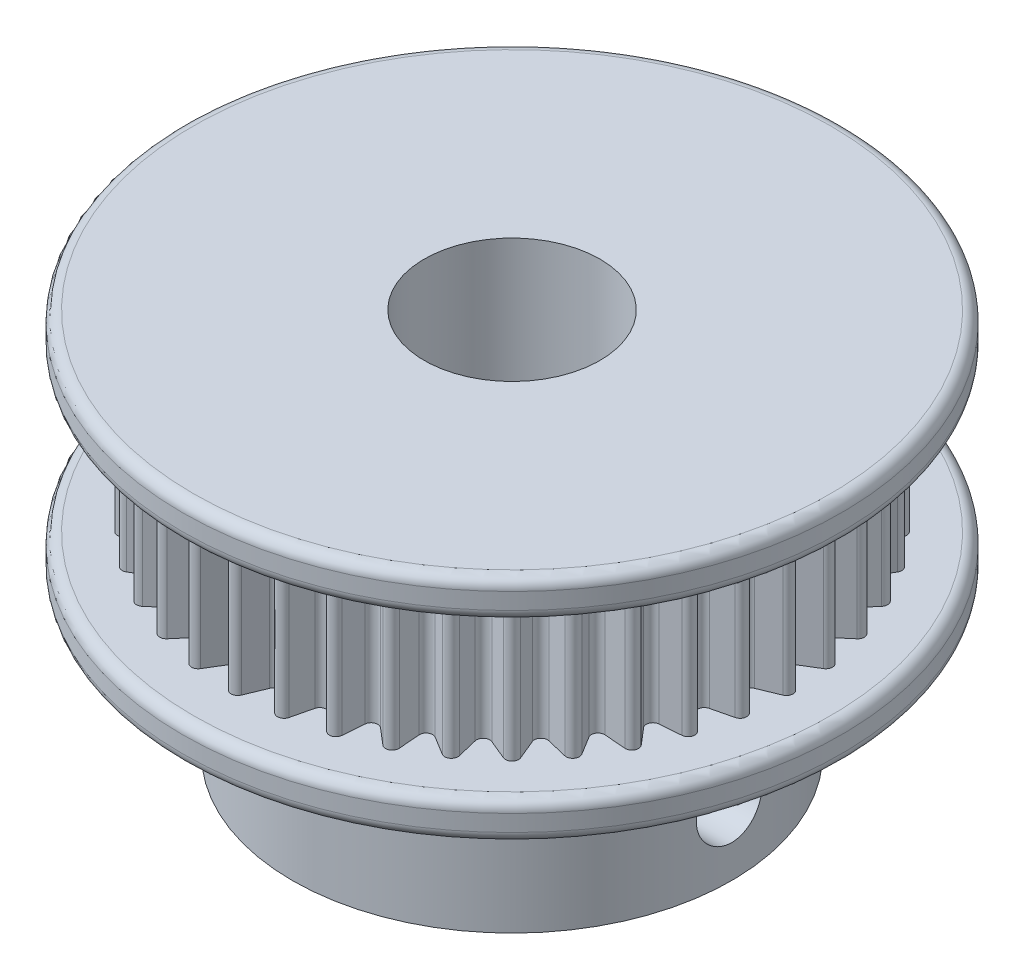
from build123d import *

# Parameters (mm, degrees)
SKETCH1_R           = 10
BOSS_EXTRUDE1_DEPTH = 7
SKETCH7_R           = 15
BOSS_EXTRUDE5_DEPTH = 1.75
BOSS_EXTRUDE7_DEPTH = 7
SKETCH8_R           = 15
BOSS_EXTRUDE6_DEPTH = 1.75
SKETCH4_R           = 4
CUT_EXTRUDE4_DEPTH  = 28.5
SKETCH5_R           = 1.5
CUT_EXTRUDE2_DEPTH  = 28.5
SKETCH6_R           = 1.5
CUT_EXTRUDE3_DEPTH  = 28.500000064
FILLET1_R           = 0.5


with BuildPart() as part:
    # Sketch1 → Boss-Extrude1 (new body)
    with BuildSketch(Plane(origin=(0, 0, 0), x_dir=(1, 0, 0), z_dir=(0, 1, 0))):
        Circle(SKETCH1_R)
    extrude(amount=BOSS_EXTRUDE1_DEPTH)

    # Sketch7 → Boss-Extrude5 (add)
    with BuildSketch(Plane(origin=(0, 7, 0), x_dir=(1, 0, 0), z_dir=(0, 1, 0))):
        Circle(SKETCH7_R)
    extrude(amount=BOSS_EXTRUDE5_DEPTH)

    # Sketch9 → Boss-Extrude7 (add)
    with BuildSketch(Plane(origin=(0, 8.75, 0), x_dir=(1, 0, 0), z_dir=(0, 1, 0))):
        with BuildLine():
            Line((2.473831286, 11.449039584), (2.244766527, 12.401442165))
            ThreePointArc((2.244766527, 12.401442165), (2.156679344, 12.551627437), (2.000014636, 12.627595435))
            ThreePointArc((2.000014636, 12.627595435), (1.827542241, 12.603757632), (1.697356551, 12.488143388))
            Line((1.697356551, 12.488143388), (1.185194436, 11.65313961))
            ThreePointArc((1.185194436, 11.65313961), (0.905928962, 11.510918866), (0.652349935, 11.695075382))
            Line((0.652349935, 11.695075382), (0.277116755, 12.599918684))
            ThreePointArc((0.277116755, 12.599918684), (0.166619919, 12.734475054), (0, 12.785))
            ThreePointArc((0, 12.785), (-0.166619919, 12.734475054), (-0.277116755, 12.599918684))
            Line((-0.277116755, 12.599918684), (-0.652349935, 11.695075382))
            ThreePointArc((-0.652349935, 11.695075382), (-0.905928962, 11.510918866), (-1.185194436, 11.65313961))
            Line((-1.185194436, 11.65313961), (-1.697356551, 12.488143388))
            ThreePointArc((-1.697356551, 12.488143388), (-1.827542241, 12.603757632), (-2.000014636, 12.627595435))
            ThreePointArc((-2.000014636, 12.627595435), (-2.156679344, 12.551627437), (-2.244766527, 12.401442165))
            Line((-2.244766527, 12.401442165), (-2.473831286, 11.449039584))
            ThreePointArc((-2.473831286, 11.449039584), (-2.695479908, 11.227481841), (-2.993555387, 11.324264867))
            Line((-2.993555387, 11.324264867), (-3.630035305, 12.068868556))
            ThreePointArc((-3.630035305, 12.068868556), (-3.776704246, 12.162693868), (-3.950782273, 12.159257561))
            ThreePointArc((-3.950782273, 12.159257561), (-4.093634166, 12.059717095), (-4.157142697, 11.897600982))
            Line((-4.157142697, 11.897600982), (-4.2343987, 10.921090434))
            ThreePointArc((-4.2343987, 10.921090434), (-4.418659193, 10.667586951), (-4.728205069, 10.716549139))
            Line((-4.728205069, 10.716549139), (-5.473330543, 11.352418126))
            ThreePointArc((-5.473330543, 11.352418126), (-5.632871259, 11.422144216), (-5.804268539, 11.391518412))
            ThreePointArc((-5.804268539, 11.391518412), (-5.929790129, 11.270856495), (-5.967156217, 11.100801377))
            Line((-5.967156217, 11.100801377), (-5.890701166, 10.124227793))
            ThreePointArc((-5.890701166, 10.124227793), (-6.033036424, 9.845020667), (-6.34643065, 9.844956406))
            Line((-6.34643065, 9.844956406), (-7.181854218, 10.356433485))
            ThreePointArc((-7.181854218, 10.356433485), (-7.350338286, 10.400343464), (-7.514834451, 10.343282273))
            ThreePointArc((-7.514834451, 10.343282273), (-7.619934979, 10.204470002), (-7.630238547, 10.030663201))
            Line((-7.630238547, 10.030663201), (-7.401955018, 9.078073063))
            ThreePointArc((-7.401955018, 9.078073063), (-7.498860275, 8.7800373), (-7.808386046, 8.730948172))
            Line((-7.808386046, 8.730948172), (-8.713536807, 9.105439081))
            ThreePointArc((-8.713536807, 9.105439081), (-8.886815591, 9.12245174), (-9.040360197, 9.040360197))
            ThreePointArc((-9.040360197, 9.040360197), (-9.12245174, 8.886815591), (-9.105439081, 8.713536807))
            Line((-9.105439081, 8.713536807), (-8.730948172, 7.808386046))
            ThreePointArc((-8.730948172, 7.808386046), (-8.7800373, 7.498860275), (-9.078073063, 7.401955018))
            Line((-9.078073063, 7.401955018), (-10.030663201, 7.630238547))
            ThreePointArc((-10.030663201, 7.630238547), (-10.204470002, 7.619934979), (-10.343282273, 7.514834451))
            ThreePointArc((-10.343282273, 7.514834451), (-10.400343464, 7.350338286), (-10.356433485, 7.181854218))
            Line((-10.356433485, 7.181854218), (-9.844956406, 6.34643065))
            ThreePointArc((-9.844956406, 6.34643065), (-9.845020667, 6.033036424), (-10.124227793, 5.890701166))
            Line((-10.124227793, 5.890701166), (-11.100801377, 5.967156217))
            ThreePointArc((-11.100801377, 5.967156217), (-11.270856495, 5.929790129), (-11.391518412, 5.804268539))
            ThreePointArc((-11.391518412, 5.804268539), (-11.422144216, 5.632871259), (-11.352418126, 5.473330543))
            Line((-11.352418126, 5.473330543), (-10.716549139, 4.728205069))
            ThreePointArc((-10.716549139, 4.728205069), (-10.667586951, 4.418659193), (-10.921090434, 4.2343987))
            Line((-10.921090434, 4.2343987), (-11.897600982, 4.157142697))
            ThreePointArc((-11.897600982, 4.157142697), (-12.059717095, 4.093634166), (-12.159257561, 3.950782273))
            ThreePointArc((-12.159257561, 3.950782273), (-12.162693868, 3.776704246), (-12.068868556, 3.630035305))
            Line((-12.068868556, 3.630035305), (-11.324264867, 2.993555387))
            ThreePointArc((-11.324264867, 2.993555387), (-11.227481841, 2.695479908), (-11.449039584, 2.473831286))
            Line((-11.449039584, 2.473831286), (-12.401442165, 2.244766527))
            ThreePointArc((-12.401442165, 2.244766527), (-12.551627437, 2.156679344), (-12.627595435, 2.000014636))
            ThreePointArc((-12.627595435, 2.000014636), (-12.603757632, 1.827542241), (-12.488143388, 1.697356551))
            Line((-12.488143388, 1.697356551), (-11.65313961, 1.185194436))
            ThreePointArc((-11.65313961, 1.185194436), (-11.510918866, 0.905928962), (-11.695075382, 0.652349935))
            Line((-11.695075382, 0.652349935), (-12.599918684, 0.277116755))
            ThreePointArc((-12.599918684, 0.277116755), (-12.734475054, 0.166619919), (-12.785, 0))
            ThreePointArc((-12.785, 0), (-12.734475054, -0.166619919), (-12.599918684, -0.277116755))
            Line((-12.599918684, -0.277116755), (-11.695075382, -0.652349935))
            ThreePointArc((-11.695075382, -0.652349935), (-11.510918866, -0.905928962), (-11.65313961, -1.185194436))
            Line((-11.65313961, -1.185194436), (-12.488143388, -1.697356551))
            ThreePointArc((-12.488143388, -1.697356551), (-12.603757632, -1.827542241), (-12.627595435, -2.000014636))
            ThreePointArc((-12.627595435, -2.000014636), (-12.551627437, -2.156679344), (-12.401442165, -2.244766527))
            Line((-12.401442165, -2.244766527), (-11.449039584, -2.473831286))
            ThreePointArc((-11.449039584, -2.473831286), (-11.227481841, -2.695479908), (-11.324264867, -2.993555387))
            Line((-11.324264867, -2.993555387), (-12.068868556, -3.630035305))
            ThreePointArc((-12.068868556, -3.630035305), (-12.162693868, -3.776704246), (-12.159257561, -3.950782273))
            ThreePointArc((-12.159257561, -3.950782273), (-12.059717095, -4.093634166), (-11.897600982, -4.157142697))
            Line((-11.897600982, -4.157142697), (-10.921090434, -4.2343987))
            ThreePointArc((-10.921090434, -4.2343987), (-10.667586951, -4.418659193), (-10.716549139, -4.728205069))
            Line((-10.716549139, -4.728205069), (-11.352418126, -5.473330543))
            ThreePointArc((-11.352418126, -5.473330543), (-11.422144216, -5.632871259), (-11.391518412, -5.804268539))
            ThreePointArc((-11.391518412, -5.804268539), (-11.270856495, -5.929790129), (-11.100801377, -5.967156217))
            Line((-11.100801377, -5.967156217), (-10.124227793, -5.890701166))
            ThreePointArc((-10.124227793, -5.890701166), (-9.845020667, -6.033036424), (-9.844956406, -6.34643065))
            Line((-9.844956406, -6.34643065), (-10.356433485, -7.181854218))
            ThreePointArc((-10.356433485, -7.181854218), (-10.400343464, -7.350338286), (-10.343282273, -7.514834451))
            ThreePointArc((-10.343282273, -7.514834451), (-10.204470002, -7.619934979), (-10.030663201, -7.630238547))
            Line((-10.030663201, -7.630238547), (-9.078073063, -7.401955018))
            ThreePointArc((-9.078073063, -7.401955018), (-8.7800373, -7.498860275), (-8.730948172, -7.808386046))
            Line((-8.730948172, -7.808386046), (-9.105439081, -8.713536807))
            ThreePointArc((-9.105439081, -8.713536807), (-9.12245174, -8.886815591), (-9.040360197, -9.040360197))
            ThreePointArc((-9.040360197, -9.040360197), (-8.886815591, -9.12245174), (-8.713536807, -9.105439081))
            Line((-8.713536807, -9.105439081), (-7.808386046, -8.730948172))
            ThreePointArc((-7.808386046, -8.730948172), (-7.498860275, -8.7800373), (-7.401955018, -9.078073063))
            Line((-7.401955018, -9.078073063), (-7.630238547, -10.030663201))
            ThreePointArc((-7.630238547, -10.030663201), (-7.619934979, -10.204470002), (-7.514834451, -10.343282273))
            ThreePointArc((-7.514834451, -10.343282273), (-7.350338286, -10.400343464), (-7.181854218, -10.356433485))
            Line((-7.181854218, -10.356433485), (-6.34643065, -9.844956406))
            ThreePointArc((-6.34643065, -9.844956406), (-6.033036424, -9.845020667), (-5.890701166, -10.124227793))
            Line((-5.890701166, -10.124227793), (-5.967156217, -11.100801377))
            ThreePointArc((-5.967156217, -11.100801377), (-5.929790129, -11.270856495), (-5.804268539, -11.391518412))
            ThreePointArc((-5.804268539, -11.391518412), (-5.632871259, -11.422144216), (-5.473330543, -11.352418126))
            Line((-5.473330543, -11.352418126), (-4.728205069, -10.716549139))
            ThreePointArc((-4.728205069, -10.716549139), (-4.418659193, -10.667586951), (-4.2343987, -10.921090434))
            Line((-4.2343987, -10.921090434), (-4.157142697, -11.897600982))
            ThreePointArc((-4.157142697, -11.897600982), (-4.093634166, -12.059717095), (-3.950782273, -12.159257561))
            ThreePointArc((-3.950782273, -12.159257561), (-3.776704246, -12.162693868), (-3.630035305, -12.068868556))
            Line((-3.630035305, -12.068868556), (-2.993555387, -11.324264867))
            ThreePointArc((-2.993555387, -11.324264867), (-2.695479908, -11.227481841), (-2.473831286, -11.449039584))
            Line((-2.473831286, -11.449039584), (-2.244766527, -12.401442165))
            ThreePointArc((-2.244766527, -12.401442165), (-2.156679344, -12.551627437), (-2.000014636, -12.627595435))
            ThreePointArc((-2.000014636, -12.627595435), (-1.827542241, -12.603757632), (-1.697356551, -12.488143388))
            Line((-1.697356551, -12.488143388), (-1.185194436, -11.65313961))
            ThreePointArc((-1.185194436, -11.65313961), (-0.905928962, -11.510918866), (-0.652349935, -11.695075382))
            Line((-0.652349935, -11.695075382), (-0.277116755, -12.599918684))
            ThreePointArc((-0.277116755, -12.599918684), (-0.166619919, -12.734475054), (0, -12.785))
            ThreePointArc((0, -12.785), (0.166619919, -12.734475054), (0.277116755, -12.599918684))
            Line((0.277116755, -12.599918684), (0.652349935, -11.695075382))
            ThreePointArc((0.652349935, -11.695075382), (0.905928962, -11.510918866), (1.185194436, -11.65313961))
            Line((1.185194436, -11.65313961), (1.697356551, -12.488143388))
            ThreePointArc((1.697356551, -12.488143388), (1.827542241, -12.603757632), (2.000014636, -12.627595435))
            ThreePointArc((2.000014636, -12.627595435), (2.156679344, -12.551627437), (2.244766527, -12.401442165))
            Line((2.244766527, -12.401442165), (2.473831286, -11.449039584))
            ThreePointArc((2.473831286, -11.449039584), (2.695479908, -11.227481841), (2.993555387, -11.324264867))
            Line((2.993555387, -11.324264867), (3.630035305, -12.068868556))
            ThreePointArc((3.630035305, -12.068868556), (3.776704246, -12.162693868), (3.950782273, -12.159257561))
            ThreePointArc((3.950782273, -12.159257561), (4.093634166, -12.059717095), (4.157142697, -11.897600982))
            Line((4.157142697, -11.897600982), (4.2343987, -10.921090434))
            ThreePointArc((4.2343987, -10.921090434), (4.418659193, -10.667586951), (4.728205069, -10.716549139))
            Line((4.728205069, -10.716549139), (5.473330543, -11.352418126))
            ThreePointArc((5.473330543, -11.352418126), (5.632871259, -11.422144216), (5.804268539, -11.391518412))
            ThreePointArc((5.804268539, -11.391518412), (5.929790129, -11.270856495), (5.967156217, -11.100801377))
            Line((5.967156217, -11.100801377), (5.890701166, -10.124227793))
            ThreePointArc((5.890701166, -10.124227793), (6.033036424, -9.845020667), (6.34643065, -9.844956406))
            Line((6.34643065, -9.844956406), (7.181854218, -10.356433485))
            ThreePointArc((7.181854218, -10.356433485), (7.350338286, -10.400343464), (7.514834451, -10.343282273))
            ThreePointArc((7.514834451, -10.343282273), (7.619934979, -10.204470002), (7.630238547, -10.030663201))
            Line((7.630238547, -10.030663201), (7.401955018, -9.078073063))
            ThreePointArc((7.401955018, -9.078073063), (7.498860275, -8.7800373), (7.808386046, -8.730948172))
            Line((7.808386046, -8.730948172), (8.713536807, -9.105439081))
            ThreePointArc((8.713536807, -9.105439081), (8.886815591, -9.12245174), (9.040360197, -9.040360197))
            ThreePointArc((9.040360197, -9.040360197), (9.12245174, -8.886815591), (9.105439081, -8.713536807))
            Line((9.105439081, -8.713536807), (8.730948172, -7.808386046))
            ThreePointArc((8.730948172, -7.808386046), (8.7800373, -7.498860275), (9.078073063, -7.401955018))
            Line((9.078073063, -7.401955018), (10.030663201, -7.630238547))
            ThreePointArc((10.030663201, -7.630238547), (10.204470002, -7.619934979), (10.343282273, -7.514834451))
            ThreePointArc((10.343282273, -7.514834451), (10.400343464, -7.350338286), (10.356433485, -7.181854218))
            Line((10.356433485, -7.181854218), (9.844956406, -6.34643065))
            ThreePointArc((9.844956406, -6.34643065), (9.845020667, -6.033036424), (10.124227793, -5.890701166))
            Line((10.124227793, -5.890701166), (11.100801377, -5.967156217))
            ThreePointArc((11.100801377, -5.967156217), (11.270856495, -5.929790129), (11.391518412, -5.804268539))
            ThreePointArc((11.391518412, -5.804268539), (11.422144216, -5.632871259), (11.352418126, -5.473330543))
            Line((11.352418126, -5.473330543), (10.716549139, -4.728205069))
            ThreePointArc((10.716549139, -4.728205069), (10.667586951, -4.418659193), (10.921090434, -4.2343987))
            Line((10.921090434, -4.2343987), (11.897600982, -4.157142697))
            ThreePointArc((11.897600982, -4.157142697), (12.059717095, -4.093634166), (12.159257561, -3.950782273))
            ThreePointArc((12.159257561, -3.950782273), (12.162693868, -3.776704246), (12.068868556, -3.630035305))
            Line((12.068868556, -3.630035305), (11.324264867, -2.993555387))
            ThreePointArc((11.324264867, -2.993555387), (11.227481841, -2.695479908), (11.449039584, -2.473831286))
            Line((11.449039584, -2.473831286), (12.401442165, -2.244766527))
            ThreePointArc((12.401442165, -2.244766527), (12.551627437, -2.156679344), (12.627595435, -2.000014636))
            ThreePointArc((12.627595435, -2.000014636), (12.603757632, -1.827542241), (12.488143388, -1.697356551))
            Line((12.488143388, -1.697356551), (11.65313961, -1.185194436))
            ThreePointArc((11.65313961, -1.185194436), (11.510918866, -0.905928962), (11.695075382, -0.652349935))
            Line((11.695075382, -0.652349935), (12.599918684, -0.277116755))
            ThreePointArc((12.599918684, -0.277116755), (12.734475054, -0.166619919), (12.785, 0))
            ThreePointArc((12.785, 0), (12.734475054, 0.166619919), (12.599918684, 0.277116755))
            Line((12.599918684, 0.277116755), (11.695075382, 0.652349935))
            ThreePointArc((11.695075382, 0.652349935), (11.510918866, 0.905928962), (11.65313961, 1.185194436))
            Line((11.65313961, 1.185194436), (12.488143388, 1.697356551))
            ThreePointArc((12.488143388, 1.697356551), (12.603757632, 1.827542241), (12.627595435, 2.000014636))
            ThreePointArc((12.627595435, 2.000014636), (12.551627437, 2.156679344), (12.401442165, 2.244766527))
            Line((12.401442165, 2.244766527), (11.449039584, 2.473831286))
            ThreePointArc((11.449039584, 2.473831286), (11.227481841, 2.695479908), (11.324264867, 2.993555387))
            Line((11.324264867, 2.993555387), (12.068868556, 3.630035305))
            ThreePointArc((12.068868556, 3.630035305), (12.162693868, 3.776704246), (12.159257561, 3.950782273))
            ThreePointArc((12.159257561, 3.950782273), (12.059717095, 4.093634166), (11.897600982, 4.157142697))
            Line((11.897600982, 4.157142697), (10.921090434, 4.2343987))
            ThreePointArc((10.921090434, 4.2343987), (10.667586951, 4.418659193), (10.716549139, 4.728205069))
            Line((10.716549139, 4.728205069), (11.352418126, 5.473330543))
            ThreePointArc((11.352418126, 5.473330543), (11.422144216, 5.632871259), (11.391518412, 5.804268539))
            ThreePointArc((11.391518412, 5.804268539), (11.270856495, 5.929790129), (11.100801377, 5.967156217))
            Line((11.100801377, 5.967156217), (10.124227793, 5.890701166))
            ThreePointArc((10.124227793, 5.890701166), (9.845020667, 6.033036424), (9.844956406, 6.34643065))
            Line((9.844956406, 6.34643065), (10.356433485, 7.181854218))
            ThreePointArc((10.356433485, 7.181854218), (10.400343464, 7.350338286), (10.343282273, 7.514834451))
            ThreePointArc((10.343282273, 7.514834451), (10.204470002, 7.619934979), (10.030663201, 7.630238547))
            Line((10.030663201, 7.630238547), (9.078073063, 7.401955018))
            ThreePointArc((9.078073063, 7.401955018), (8.7800373, 7.498860275), (8.730948172, 7.808386046))
            Line((8.730948172, 7.808386046), (9.105439081, 8.713536807))
            ThreePointArc((9.105439081, 8.713536807), (9.12245174, 8.886815591), (9.040360197, 9.040360197))
            ThreePointArc((9.040360197, 9.040360197), (8.886815591, 9.12245174), (8.713536807, 9.105439081))
            Line((8.713536807, 9.105439081), (7.808386046, 8.730948172))
            ThreePointArc((7.808386046, 8.730948172), (7.498860275, 8.7800373), (7.401955018, 9.078073063))
            Line((7.401955018, 9.078073063), (7.630238547, 10.030663201))
            ThreePointArc((7.630238547, 10.030663201), (7.619934979, 10.204470002), (7.514834451, 10.343282273))
            ThreePointArc((7.514834451, 10.343282273), (7.350338286, 10.400343464), (7.181854218, 10.356433485))
            Line((7.181854218, 10.356433485), (6.34643065, 9.844956406))
            ThreePointArc((6.34643065, 9.844956406), (6.033036424, 9.845020667), (5.890701166, 10.124227793))
            Line((5.890701166, 10.124227793), (5.967156217, 11.100801377))
            ThreePointArc((5.967156217, 11.100801377), (5.929790129, 11.270856495), (5.804268539, 11.391518412))
            ThreePointArc((5.804268539, 11.391518412), (5.632871259, 11.422144216), (5.473330543, 11.352418126))
            Line((5.473330543, 11.352418126), (4.728205069, 10.716549139))
            ThreePointArc((4.728205069, 10.716549139), (4.418659193, 10.667586951), (4.2343987, 10.921090434))
            Line((4.2343987, 10.921090434), (4.157142697, 11.897600982))
            ThreePointArc((4.157142697, 11.897600982), (4.093634166, 12.059717095), (3.950782273, 12.159257561))
            ThreePointArc((3.950782273, 12.159257561), (3.776704246, 12.162693868), (3.630035305, 12.068868556))
            Line((3.630035305, 12.068868556), (2.993555387, 11.324264867))
            ThreePointArc((2.993555387, 11.324264867), (2.695479908, 11.227481841), (2.473831286, 11.449039584))
        make_face()
    extrude(amount=BOSS_EXTRUDE7_DEPTH)

    # Sketch8 → Boss-Extrude6 (add)
    with BuildSketch(Plane(origin=(0, 15.75, 0), x_dir=(1, 0, 0), z_dir=(0, 1, 0))):
        Circle(SKETCH8_R)
    extrude(amount=BOSS_EXTRUDE6_DEPTH)

    # Sketch4 → Cut-Extrude4 (cut, through all)
    with BuildSketch(Plane.XZ):
        Circle(SKETCH4_R)
    extrude(amount=-CUT_EXTRUDE4_DEPTH, mode=Mode.SUBTRACT)

    # Sketch5 → Cut-Extrude2 (cut, through all)
    with BuildSketch(Plane(origin=(0, 0, 0), x_dir=(0, 0, -1), z_dir=(1, 0, 0))):
        with Locations((0, 3)):
            Circle(SKETCH5_R)
    extrude(amount=CUT_EXTRUDE2_DEPTH, mode=Mode.SUBTRACT)

    # Sketch6 → Cut-Extrude3 (cut, through all)
    with BuildSketch(Plane.XY):
        with Locations((0, 3)):
            Circle(SKETCH6_R)
    extrude(amount=-CUT_EXTRUDE3_DEPTH, mode=Mode.SUBTRACT)

    # Fillet1
    fillet1_edges = [part.edges().sort_by_distance(p)[0] for p in [
        (-15, 7, 0),
        (-15, 8.75, 0),
        (-15, 15.75, 0),
        (-15, 17.5, 0),
    ]]
    fillet(fillet1_edges, radius=FILLET1_R)


solid = part.part
